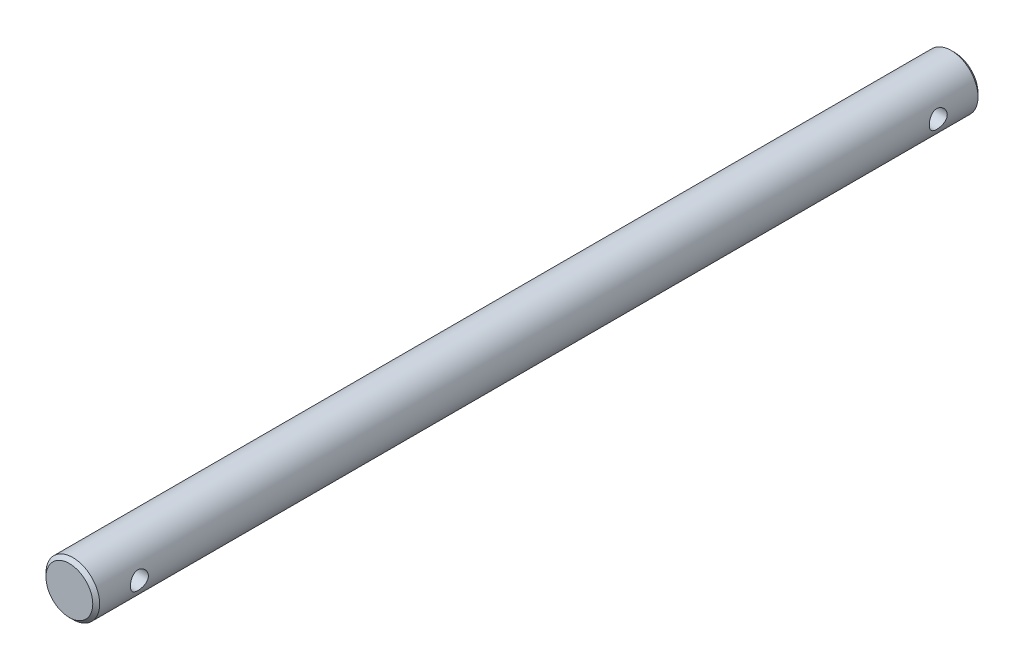
from build123d import *

# Parameters (mm, degrees)
SKETCH1_R                   = 3.9497
BOSS_EXTRUDE1_DEPTH         = 130.175
F_37_0_104_DIAMETER_HOLE1_D = 2.6416
CHAMFER1_SIZE               = 0.508


with BuildPart() as part:
    # Sketch1 → Boss-Extrude1 (new body)
    with BuildSketch(Plane.XY):
        Circle(SKETCH1_R)
    extrude(amount=BOSS_EXTRUDE1_DEPTH)

    # #37 (0.104) Diameter Hole1 (through all)
    with Locations(Plane(origin=(3.9497, 0, 0), x_dir=(0, 0, -1), z_dir=(1, 0, 0))):
        with Locations((-6.35, 0), (-123.825, 0)):
            Hole(F_37_0_104_DIAMETER_HOLE1_D / 2)

    # Chamfer1
    chamfer1_edges = [part.edges().sort_by_distance(p)[0] for p in [
        (-3.9497, 0, 0),
        (-3.9497, 0, 130.175),
    ]]
    chamfer(chamfer1_edges, length=CHAMFER1_SIZE)


solid = part.part
